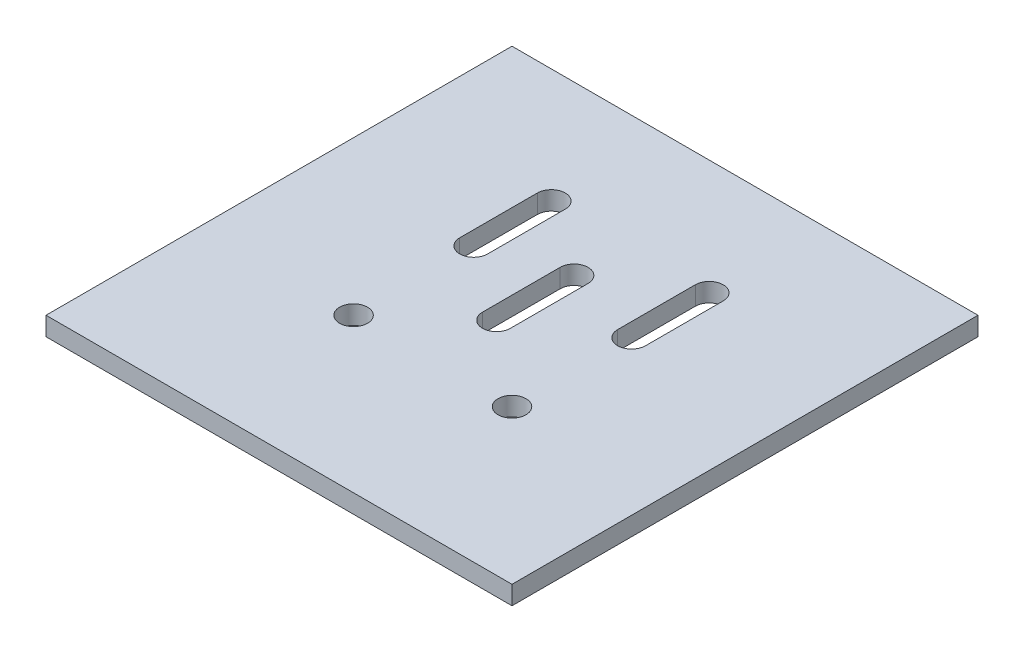
from build123d import *

# Parameters (mm, degrees)
SKETCH1_W           = 50
SKETCH1_H           = 50
SKETCH1_R           = 1.5
BOSS_EXTRUDE1_DEPTH = 2


with BuildPart() as part:
    # Sketch1 → Boss-Extrude1 (new body)
    with BuildSketch(Plane(origin=(0, 0, 0), x_dir=(1, 0, 0), z_dir=(0, 1, 0))):
        Rectangle(SKETCH1_W, SKETCH1_H)
        with Locations(Location((8.5, -8.5, 0), (0, 0, 270))):
            Circle(SKETCH1_R, mode=Mode.SUBTRACT)
        with Locations(Location((-8.5, -8.5, 0), (0, 0, 270))):
            Circle(SKETCH1_R, mode=Mode.SUBTRACT)
        with BuildLine():
            Line((-10.002005601, 4.390529846), (-10.002005601, 12.719094592))
            ThreePointArc((-10.002005601, 12.719094592), (-8.502005601, 14.219094592), (-7.002005601, 12.719094592))
            Line((-7.002005601, 12.719094592), (-7.002005601, 4.390529846))
            ThreePointArc((-7.002005601, 4.390529846), (-8.502005601, 2.890529846), (-10.002005601, 4.390529846))
        make_face(mode=Mode.SUBTRACT)
        with BuildLine():
            Line((7, 4.335717627), (7, 12.664282373))
            ThreePointArc((7, 12.664282373), (8.5, 14.164282373), (10, 12.664282373))
            Line((10, 12.664282373), (10, 4.335717627))
            ThreePointArc((10, 4.335717627), (8.5, 2.835717627), (7, 4.335717627))
        make_face(mode=Mode.SUBTRACT)
        with BuildLine():
            Line((-1.870832872, -1.293852114), (-1.870832872, 7.034712631))
            ThreePointArc((-1.870832872, 7.034712631), (-0.370832872, 8.534712631), (1.129167128, 7.034712631))
            Line((1.129167128, 7.034712631), (1.129167128, -1.293852114))
            ThreePointArc((1.129167128, -1.293852114), (-0.370832872, -2.793852114), (-1.870832872, -1.293852114))
        make_face(mode=Mode.SUBTRACT)
    extrude(amount=BOSS_EXTRUDE1_DEPTH)


solid = part.part
